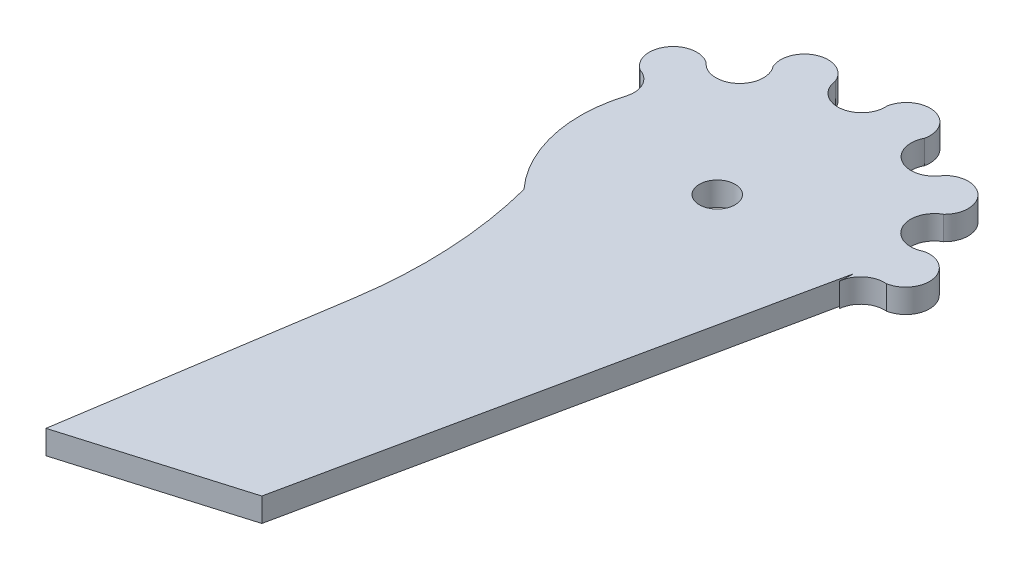
from build123d import *

# Parameters (mm, degrees)
SKETCH1_R           = 1.5
BOSS_EXTRUDE3_DEPTH = 1
BOSS_EXTRUDE5_DEPTH = 1


with BuildPart() as part:
    # Sketch1 → Boss-Extrude3 (new, symmetric)
    with BuildSketch(Plane(origin=(0, 0, 0), x_dir=(1, 0, 0), z_dir=(0, 1, 0))):
        with BuildLine():
            Line((10.514574075, -4.657653059), (11.5, 0))
            ThreePointArc((11.5, 0), (11.485144533, -0.58434155), (11.440616514, -1.167173419))
            ThreePointArc((11.440616514, -1.167173419), (12.15387442, 0.169569159), (13.599672235, 0.622654405))
            ThreePointArc((13.599672235, 0.622654405), (15.211699124, 2.97560242), (12.831884171, 4.547695243))
            ThreePointArc((12.831884171, 4.547695243), (10.157548748, 5.392050021), (10.95665555, 8.080252631))
            ThreePointArc((10.95665555, 8.080252631), (10.987967437, 10.932272023), (8.135825754, 10.91545339))
            ThreePointArc((8.135825754, 10.91545339), (5.443597104, 10.130017304), (4.612843157, 12.808608879))
            ThreePointArc((4.612843157, 12.808608879), (3.052863924, 15.196381867), (0.691754597, 13.596332557))
            ThreePointArc((0.691754597, 13.596332557), (-1.109021523, 11.446399926), (-3.289035023, 13.210640864))
            ThreePointArc((-3.289035023, 13.210640864), (-5.913396009, 14.327656739), (-6.985968373, 11.684820465))
            ThreePointArc((-6.985968373, 11.684820465), (-7.287049374, 8.896567395), (-10.079986001, 9.150555482))
            ThreePointArc((-10.079986001, 9.150555482), (-12.882306434, 8.619523243), (-12.304062381, 5.826562651))
            ThreePointArc((-12.304062381, 5.826562651), (-11.145420085, 4.850260698), (-11.003753067, 3.341768759))
            ThreePointArc((-11.003753067, 3.341768759), (-4.007182474, -10.77926197), (10.514574075, -4.657653059))
        make_face()
        with Locations(Location((0, 0, 0), (0, 0, 270))):
            Circle(SKETCH1_R, mode=Mode.SUBTRACT)
    extrude(amount=BOSS_EXTRUDE3_DEPTH, both=True)

    # Sketch1<5> → Boss-Extrude5 (add, symmetric)
    with BuildSketch(Plane(origin=(0, 0, 0), x_dir=(1, 0, 0), z_dir=(0, 1, 0))):
        with BuildLine():
            Line((2.806807826, -41.088702969), (10.514574075, -4.657653059))
            ThreePointArc((10.514574075, -4.657653059), (1.846708509, -11.35075626), (-8.495825279, -7.750545324))
            ThreePointArc((-8.495825279, -7.750545324), (-7.347088724, -15.263704681), (-7.738414168, -22.854094893))
            Line((-7.738414168, -22.854094893), (-11.192007229, -45.231550072))
            Line((-11.192007229, -45.231550072), (2.806807826, -41.088702969))
        make_face()
    extrude(amount=BOSS_EXTRUDE5_DEPTH, both=True)


solid = part.part
